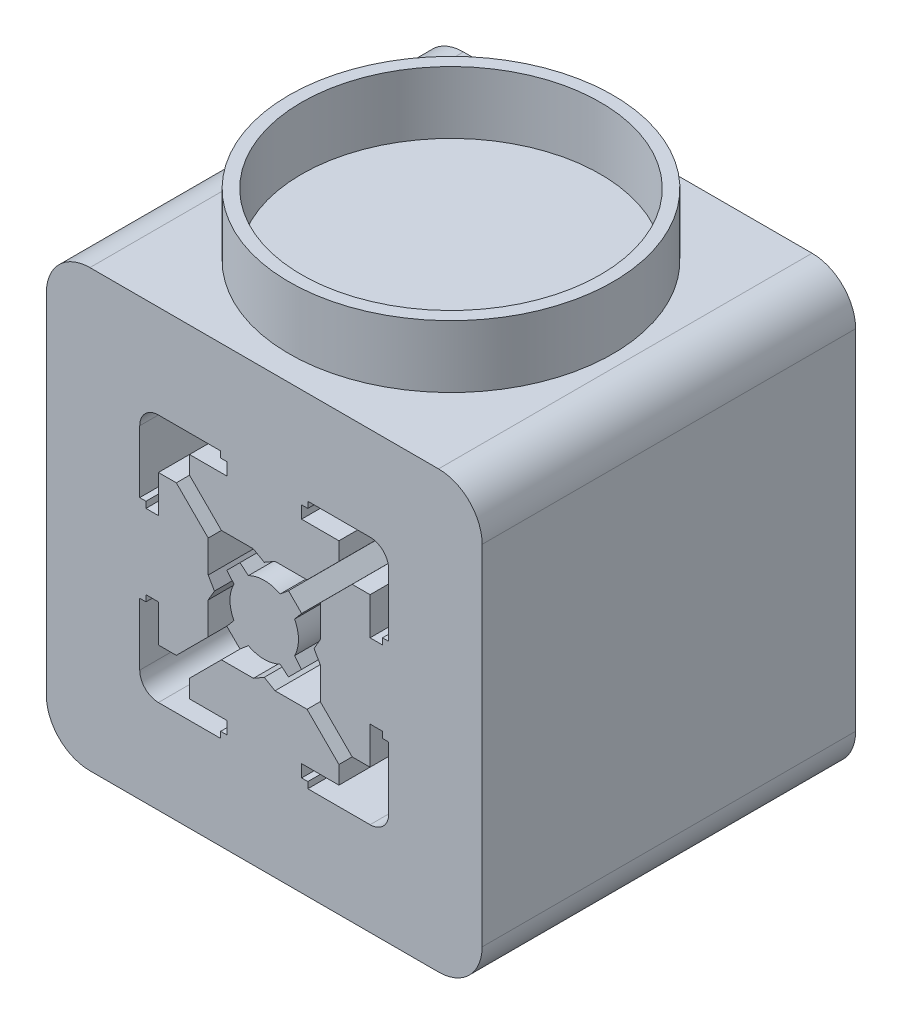
from build123d import *

# Parameters (mm, degrees)
ESQUISSE1_R          = 2.75
BOSS_EXTRU_1_DEPTH   = 30
BOSS_EXTRU_1_2_DEPTH = 30
ESQUISSE3_R          = 13
ESQUISSE3_R_2        = 12
BOSS_EXTRU_2_DEPTH   = 5
BOSS_EXTRU_3_START   = -30
BOSS_EXTRU_3_DEPTH   = 30


with BuildPart() as part:
    # Esquisse1 → Boss.-Extru.1 (new body)
    with BuildSketch(Plane.XY):
        Circle(ESQUISSE1_R)
    extrude(amount=BOSS_EXTRU_1_DEPTH)

    # Esquisse4 → Boss.-Extru.3 (add)
    with BuildSketch(Plane.XY.offset(30).offset(BOSS_EXTRU_3_START)):
        with BuildLine():
            Line((1.949592103, 3.000876196), (1.276279893, 2.435900169))
            ThreePointArc((1.276279893, 2.435900169), (0.001756003, 2.749999439), (-1.273167982, 2.43752811))
            Line((-1.273167982, 2.43752811), (-1.947287092, 3.003181207))
            Line((-1.947287092, 3.003181207), (-3.000876196, 1.949592103))
            Line((-3.000876196, 1.949592103), (-2.435900169, 1.276279893))
            ThreePointArc((-2.435900169, 1.276279893), (-2.749999439, 0.001756003), (-2.43752811, -1.273167982))
            Line((-2.43752811, -1.273167982), (-3.003181207, -1.947287092))
            Line((-3.003181207, -1.947287092), (-1.949592103, -3.000876196))
            Line((-1.949592103, -3.000876196), (-1.276279893, -2.435900169))
            ThreePointArc((-1.276279893, -2.435900169), (-0.001756003, -2.749999439), (1.273167982, -2.43752811))
            Line((1.273167982, -2.43752811), (1.947287092, -3.003181207))
            Line((1.947287092, -3.003181207), (3.000876196, -1.949592103))
            Line((3.000876196, -1.949592103), (2.435900169, -1.276279893))
            ThreePointArc((2.435900169, -1.276279893), (2.749999439, -0.001756003), (2.43752811, 1.273167982))
            Line((2.43752811, 1.273167982), (3.003181207, 1.947287092))
            Line((3.003181207, 1.947287092), (1.949592103, 3.000876196))
        make_face()
    extrude(amount=BOSS_EXTRU_3_DEPTH)


with BuildPart() as body_2:
    # Esquisse1 → Boss.-Extru.1 2 (new body)
    with BuildSketch(Plane.XY):
        with BuildLine():
            Line((-14, 17.5), (14, 17.5))
            ThreePointArc((14, 17.5), (16.474873734, 16.474873734), (17.5, 14))
            Line((17.5, 14), (17.5, -14))
            ThreePointArc((17.5, -14), (16.474873734, -16.474873734), (14, -17.5))
            Line((14, -17.5), (-14, -17.5))
            ThreePointArc((-14, -17.5), (-16.474873734, -16.474873734), (-17.5, -14))
            Line((-17.5, -14), (-17.5, 14))
            ThreePointArc((-17.5, 14), (-16.474873734, 16.474873734), (-14, 17.5))
        make_face()
        with BuildLine():
            Line((-4, 0), (-4.5, 0.866025404))
            Line((-4.5, 0.866025404), (-4.5, 3.439339828))
            Line((-4.5, 3.439339828), (-7.060660172, 6))
            Line((-7.060660172, 6), (-8.5, 6))
            Line((-8.5, 6), (-8.5, 3))
            Line((-8.5, 3), (-9.5, 3))
            Line((-9.5, 3), (-9.5, 3.5))
            Line((-9.5, 3.5), (-10, 3.5))
            Line((-10, 3.5), (-10, 8.5))
            ThreePointArc((-10, 8.5), (-9.560660172, 9.560660172), (-8.5, 10))
            Line((-8.5, 10), (-3.5, 10))
            Line((-3.5, 10), (-3.5, 9.5))
            Line((-3.5, 9.5), (-3, 9.5))
            Line((-3, 9.5), (-3, 8.5))
            Line((-3, 8.5), (-6, 8.5))
            Line((-6, 8.5), (-6, 7.060660172))
            Line((-6, 7.060660172), (-3.439339828, 4.5))
            Line((-3.439339828, 4.5), (-0.866025404, 4.5))
            Line((-0.866025404, 4.5), (0, 4))
            Line((0, 4), (0.866025404, 4.5))
            Line((0.866025404, 4.5), (3.439339828, 4.5))
            Line((3.439339828, 4.5), (6, 7.060660172))
            Line((6, 7.060660172), (6, 8.5))
            Line((6, 8.5), (3, 8.5))
            Line((3, 8.5), (3, 9.5))
            Line((3, 9.5), (3.5, 9.5))
            Line((3.5, 9.5), (3.5, 10))
            Line((3.5, 10), (8.5, 10))
            ThreePointArc((8.5, 10), (9.560660172, 9.560660172), (10, 8.5))
            Line((10, 8.5), (10, 3.5))
            Line((10, 3.5), (9.5, 3.5))
            Line((9.5, 3.5), (9.5, 3))
            Line((9.5, 3), (8.5, 3))
            Line((8.5, 3), (8.5, 6))
            Line((8.5, 6), (7.060660172, 6))
            Line((7.060660172, 6), (4.5, 3.439339828))
            Line((4.5, 3.439339828), (4.5, 0.866025404))
            Line((4.5, 0.866025404), (4, 0))
            Line((4, 0), (4.5, -0.866025404))
            Line((4.5, -0.866025404), (4.5, -3.439339828))
            Line((4.5, -3.439339828), (7.060660172, -6))
            Line((7.060660172, -6), (8.5, -6))
            Line((8.5, -6), (8.5, -3))
            Line((8.5, -3), (9.5, -3))
            Line((9.5, -3), (9.5, -3.5))
            Line((9.5, -3.5), (10, -3.5))
            Line((10, -3.5), (10, -8.5))
            ThreePointArc((10, -8.5), (9.560660172, -9.560660172), (8.5, -10))
            Line((8.5, -10), (3.5, -10))
            Line((3.5, -10), (3.5, -9.5))
            Line((3.5, -9.5), (3, -9.5))
            Line((3, -9.5), (3, -8.5))
            Line((3, -8.5), (6, -8.5))
            Line((6, -8.5), (6, -7.060660172))
            Line((6, -7.060660172), (3.439339828, -4.5))
            Line((3.439339828, -4.5), (0.866025404, -4.5))
            Line((0.866025404, -4.5), (0, -4))
            Line((0, -4), (-0.866025404, -4.5))
            Line((-0.866025404, -4.5), (-3.439339828, -4.5))
            Line((-3.439339828, -4.5), (-6, -7.060660172))
            Line((-6, -7.060660172), (-6, -8.5))
            Line((-6, -8.5), (-3, -8.5))
            Line((-3, -8.5), (-3, -9.5))
            Line((-3, -9.5), (-3.5, -9.5))
            Line((-3.5, -9.5), (-3.5, -10))
            Line((-3.5, -10), (-8.5, -10))
            ThreePointArc((-8.5, -10), (-9.560660172, -9.560660172), (-10, -8.5))
            Line((-10, -8.5), (-10, -3.5))
            Line((-10, -3.5), (-9.5, -3.5))
            Line((-9.5, -3.5), (-9.5, -3))
            Line((-9.5, -3), (-8.5, -3))
            Line((-8.5, -3), (-8.5, -6))
            Line((-8.5, -6), (-7.060660172, -6))
            Line((-7.060660172, -6), (-4.5, -3.439339828))
            Line((-4.5, -3.439339828), (-4.5, -0.866025404))
            Line((-4.5, -0.866025404), (-4, 0))
        make_face(mode=Mode.SUBTRACT)
    extrude(amount=BOSS_EXTRU_1_2_DEPTH)

    # Esquisse3 → Boss.-Extru.2 (add)
    with BuildSketch(Plane(origin=(0, 17.5, 0), x_dir=(1, 0, 0), z_dir=(0, 1, 0))):
        with Locations(Location((0, -15, 0), (0, 0, 180))):
            Circle(ESQUISSE3_R)
        with Locations(Location((0, -15, 0), (0, 0, 180))):
            Circle(ESQUISSE3_R_2, mode=Mode.SUBTRACT)
    extrude(amount=BOSS_EXTRU_2_DEPTH)


solid = Compound([part.part, body_2.part])
